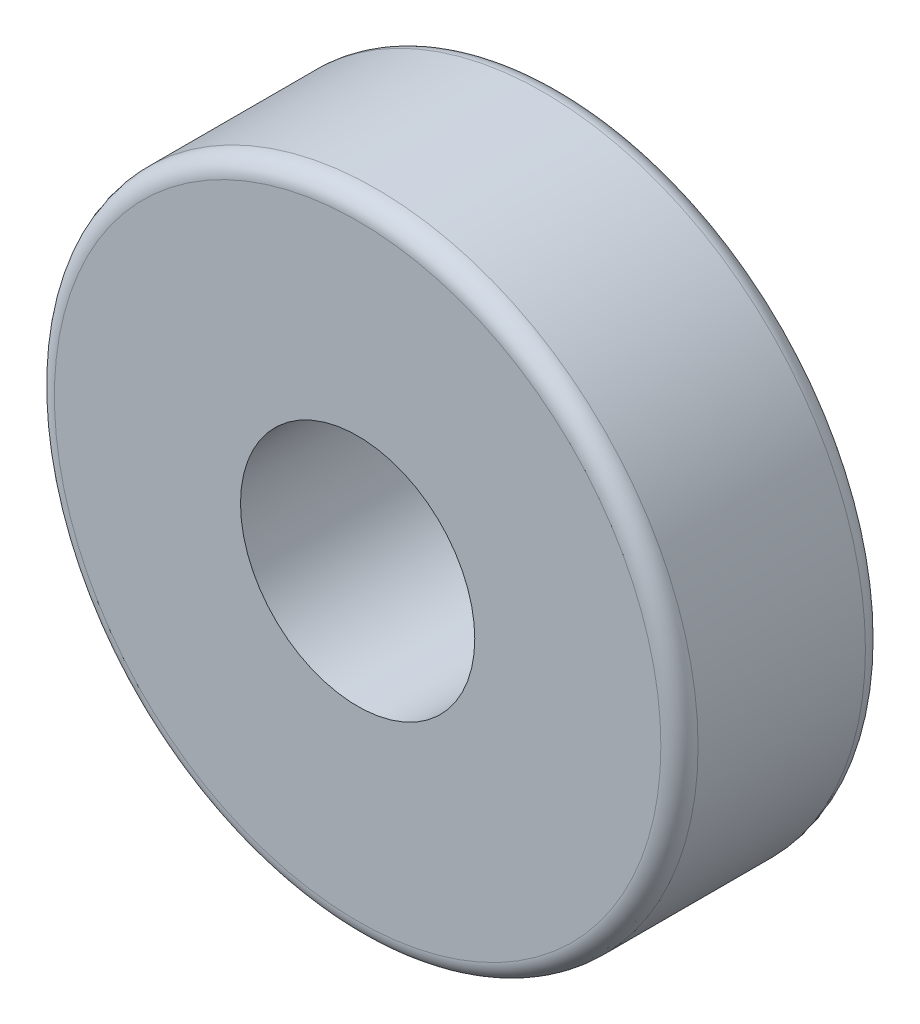
from build123d import *

# Parameters (mm, degrees)
SKETCH1_R           = 10.99185
SKETCH1_R_2         = 4.0005
BOSS_EXTRUDE1_DEPTH = 6.985
FILLET1_R           = 0.635


with BuildPart() as part:
    # Sketch1 → Boss-Extrude1 (new body)
    with BuildSketch(Plane.XY):
        Circle(SKETCH1_R)
        Circle(SKETCH1_R_2, mode=Mode.SUBTRACT)
    extrude(amount=BOSS_EXTRUDE1_DEPTH)

    # Fillet1
    fillet1_edges = [part.edges().sort_by_distance(p)[0] for p in [
        (-10.99185, 0, 0),
        (-10.99185, 0, 6.985),
    ]]
    fillet(fillet1_edges, radius=FILLET1_R)


solid = part.part
